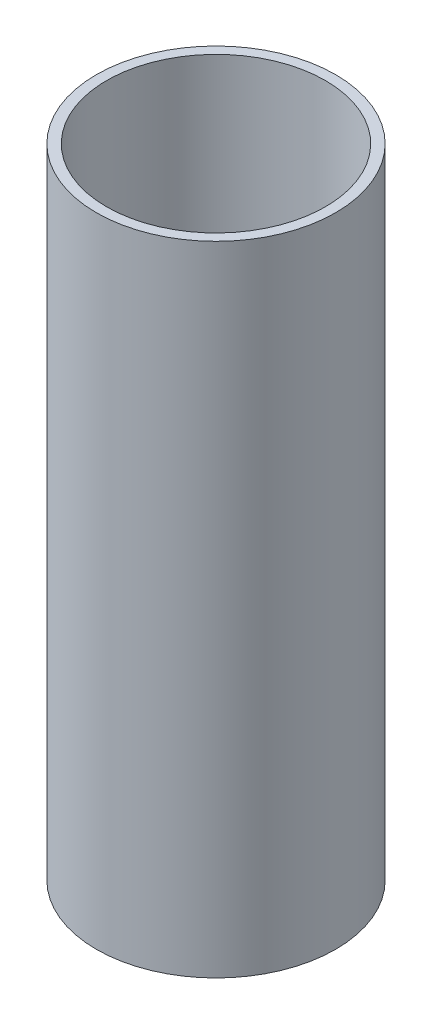
from build123d import *

# Parameters (mm, degrees)
SKETCH1_R           = 9.525
BOSS_EXTRUDE1_DEPTH = 50.8
SKETCH2_R           = 8.7122
CUT_EXTRUDE1_DEPTH  = 53.555601509


with BuildPart() as part:
    # Sketch1 → Boss-Extrude1 (new body)
    with BuildSketch(Plane(origin=(0, 0, 0), x_dir=(1, 0, 0), z_dir=(0, 1, 0))):
        with Locations(Location((0, 0, 0), (0, 0, 270))):
            Circle(SKETCH1_R)
    extrude(amount=BOSS_EXTRUDE1_DEPTH)

    # Sketch2 → Cut-Extrude1 (cut, through all)
    with BuildSketch(Plane(origin=(0, 50.8, 0), x_dir=(1, 0, 0), z_dir=(0, 1, 0))):
        with Locations(Location((0, 0, 0), (0, 0, 270))):
            Circle(SKETCH2_R)
    extrude(amount=-CUT_EXTRUDE1_DEPTH, mode=Mode.SUBTRACT)


solid = part.part
